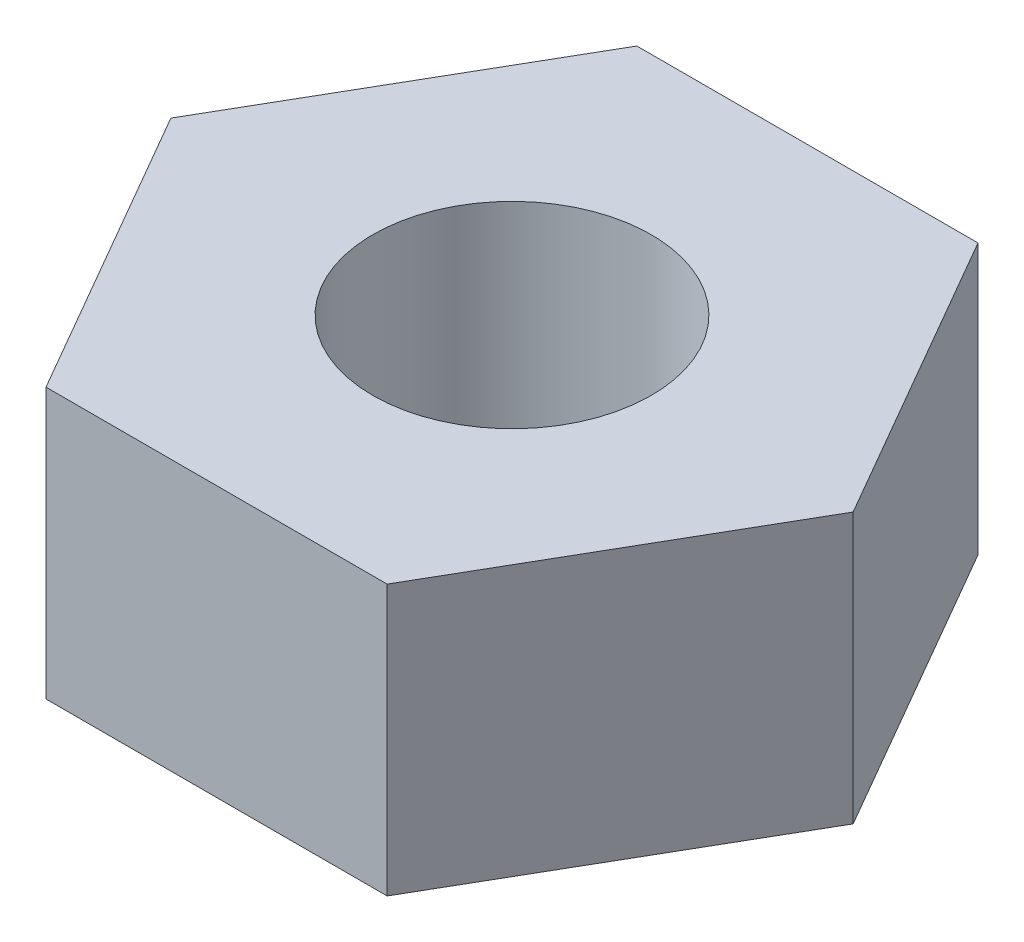
from build123d import *

# Parameters (mm, degrees)
SKETCH1_R                   = 2
BOSS_EXTRUDE1_DEPTH         = 3.2
TAP_DRILL_FOR_M4X0_7_TAP1_D = 3.3


with BuildPart() as part:
    # Sketch1 → Boss-Extrude1 (new body)
    # profile 1 of 2: a face of its own
    with BuildSketch(Plane(origin=(0, 0, 0), x_dir=(1, 0, 0), z_dir=(0, 1, 0))):
        Polygon((2.020725942, 3.5), (-2.020725942, 3.5), (-4.041451884, 0), (-2.020725942, -3.5), (2.020725942, -3.5), (4.041451884, 0), align=None)
        Circle(SKETCH1_R, mode=Mode.SUBTRACT)
    # profile 2 of 2: a face of its own
    with BuildSketch(Plane(origin=(0, 0, 0), x_dir=(1, 0, 0), z_dir=(0, 1, 0))):
        Circle(SKETCH1_R)
    extrude(amount=BOSS_EXTRUDE1_DEPTH)

    # Tap Drill for M4x0.7 Tap1 (through all)
    with Locations(Plane(origin=(0, 3.2, 0), x_dir=(1, 0, 0), z_dir=(0, 1, 0))):
        with Locations((0, 0)):
            Hole(TAP_DRILL_FOR_M4X0_7_TAP1_D / 2)


solid = part.part
